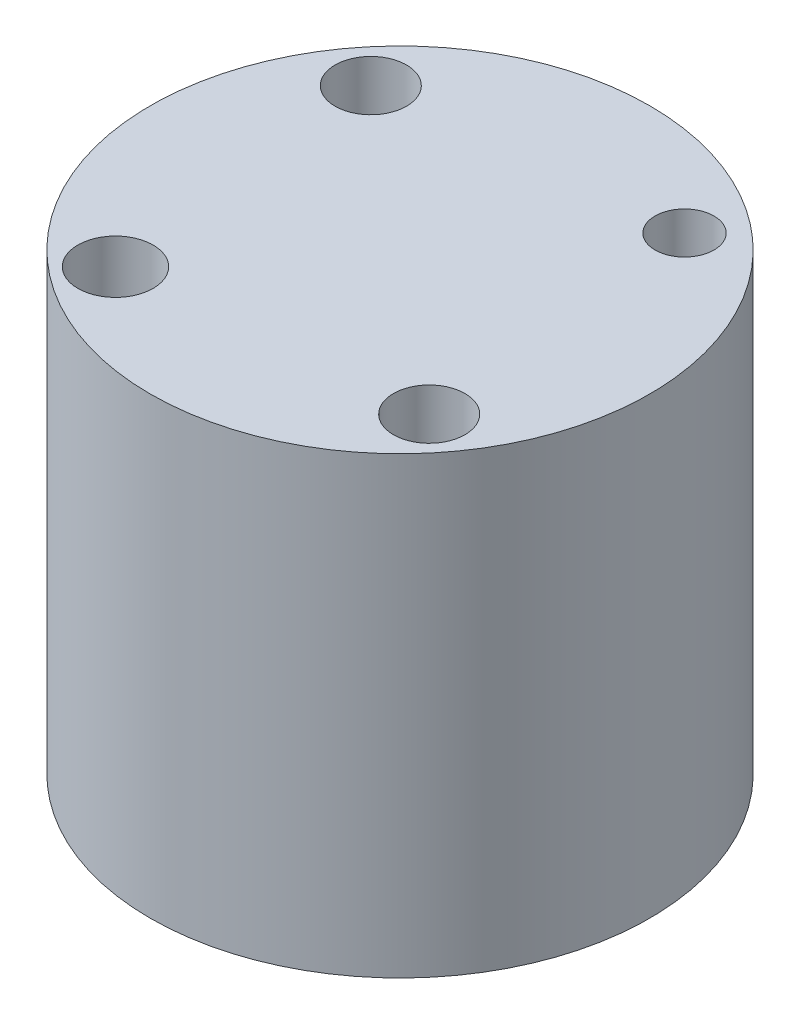
from build123d import *

# Parameters (mm, degrees)
SKETCH1_R           = 13.97
SKETCH1_R_2         = 2
SKETCH1_R_3         = 1.65
SKETCH1_R_4         = 2.104990058
BOSS_EXTRUDE1_DEPTH = 25.4


with BuildPart() as part:
    # Sketch1 → Boss-Extrude1 (new body)
    with BuildSketch(Plane(origin=(0, 0, 0), x_dir=(1, 0, 0), z_dir=(0, 1, 0))):
        with Locations(Location((0, 0, 0), (0, 0, 270))):
            Circle(SKETCH1_R)
        with Locations(Location((-8.775103202, 7.141257858, 0), (0, 0, 270))):
            Circle(SKETCH1_R_2, mode=Mode.SUBTRACT)
        with Locations(Location((7.141257858, 8.775103202, 0), (0, 0, 270))):
            Circle(SKETCH1_R_3, mode=Mode.SUBTRACT)
        with Locations(Location((-7.141257858, -8.775103202, 0), (0, 0, 270))):
            Circle(SKETCH1_R_4, mode=Mode.SUBTRACT)
        with Locations(Location((8.775103202, -7.141257858, 0), (0, 0, 270))):
            Circle(SKETCH1_R_2, mode=Mode.SUBTRACT)
    extrude(amount=BOSS_EXTRUDE1_DEPTH)


solid = part.part
